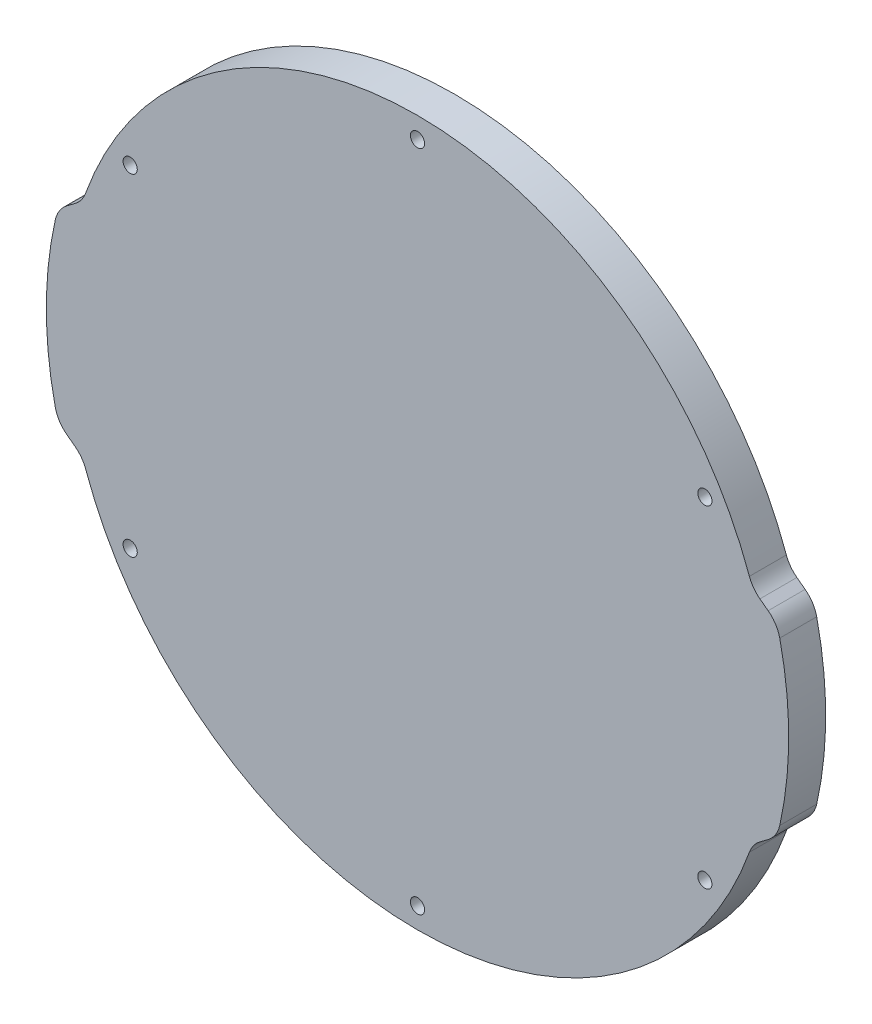
from build123d import *

# Parameters (mm, degrees)
ESQUISSE1_R        = 1.15
BOSS_EXTRU_1_DEPTH = 6
CONG_1_R           = 5


with BuildPart() as part:
    # Esquisse1 → Boss.-Extru.1 (new body)
    with BuildSketch(Plane.XY):
        with BuildLine():
            Line((-58.352913381, 15), (-54.346688032, 18))
            ThreePointArc((-54.346688032, 18), (0, 57.25), (54.346688032, 18))
            Line((54.346688032, 18), (58.352913381, 15))
            ThreePointArc((58.352913381, 15), (60.25, 0), (58.352913381, -15))
            Line((58.352913381, -15), (54.346688032, -18))
            ThreePointArc((54.346688032, -18), (0, -57.25), (-54.346688032, -18))
            Line((-54.346688032, -18), (-58.352913381, -15))
            ThreePointArc((-58.352913381, -15), (-60.25, 0), (-58.352913381, 15))
        make_face()
        with Locations((0, 53.85)):
            Circle(ESQUISSE1_R, mode=Mode.SUBTRACT)
        with Locations((46.635467994, 26.925)):
            Circle(ESQUISSE1_R, mode=Mode.SUBTRACT)
        with Locations((46.635467994, -26.925)):
            Circle(ESQUISSE1_R, mode=Mode.SUBTRACT)
        with Locations((0, -53.85)):
            Circle(ESQUISSE1_R, mode=Mode.SUBTRACT)
        with Locations((-46.635467994, -26.925)):
            Circle(ESQUISSE1_R, mode=Mode.SUBTRACT)
        with Locations((-46.635467994, 26.925)):
            Circle(ESQUISSE1_R, mode=Mode.SUBTRACT)
    extrude(amount=BOSS_EXTRU_1_DEPTH)

    # Congé1
    cong_1_edges = [part.edges().sort_by_distance(p)[0] for p in [
        (-54.346688032, -18, 3),
        (-58.352913381, -15, 3),
        (-58.352913381, 15, 3),
        (-54.346688032, 18, 3),
        (54.346688032, 18, 3),
        (58.352913381, 15, 3),
        (58.352913381, -15, 3),
        (54.346688032, -18, 3),
    ]]
    fillet(cong_1_edges, radius=CONG_1_R)


solid = part.part
